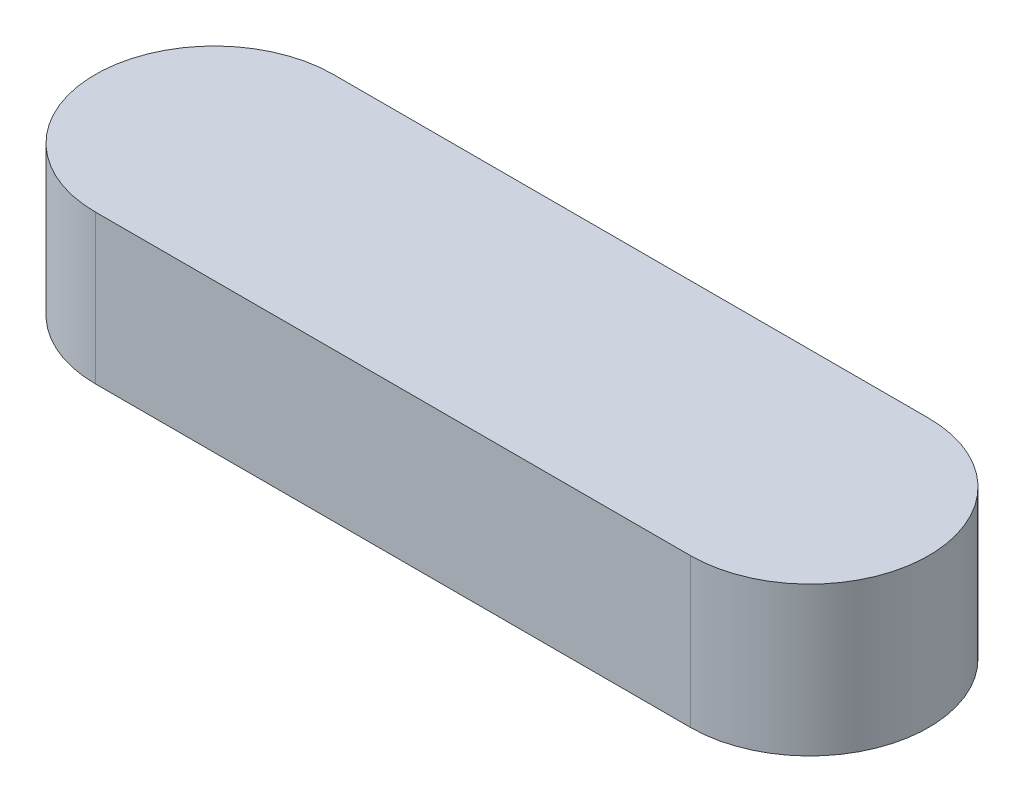
from build123d import *

# Parameters (mm, degrees)
BODY_DEPTH = 10


with BuildPart() as part:
    # Sketch4 → body (new body)
    with BuildSketch(Plane(origin=(0, 0, 0), x_dir=(1, 0, 0), z_dir=(0, 1, 0))):
        with BuildLine():
            Line((20, 8), (-20, 8))
            ThreePointArc((-20, 8), (-28, 0), (-20, -8))
            Line((-20, -8), (20, -8))
            ThreePointArc((20, -8), (28, 0), (20, 8))
        make_face()
    extrude(amount=BODY_DEPTH)


solid = part.part
